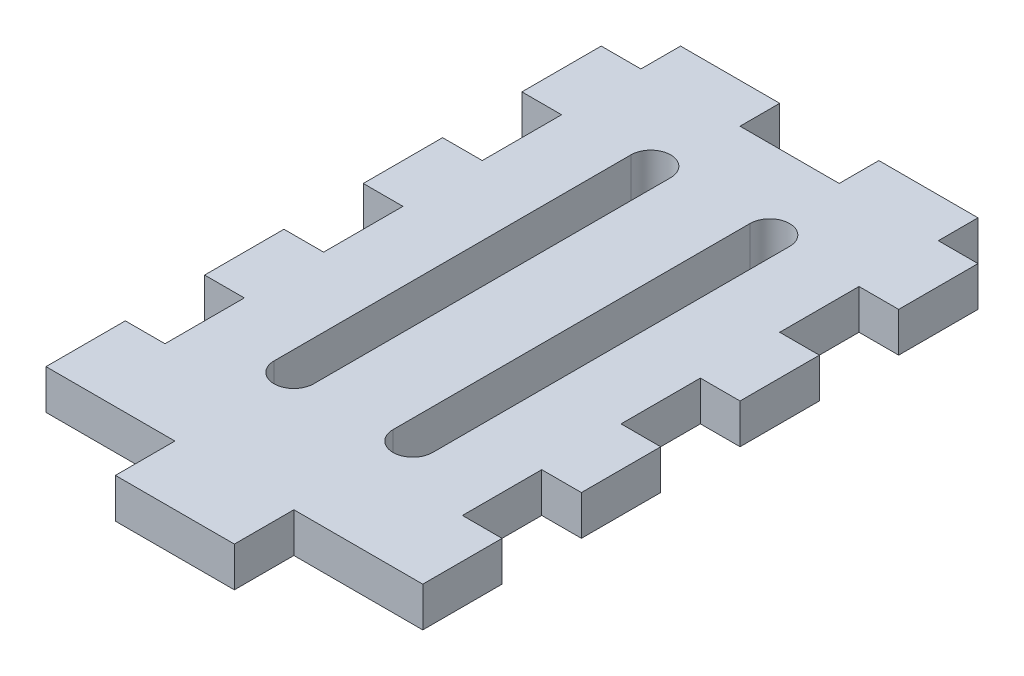
from build123d import *

# Parameters (mm, degrees)
BOSS_EXTRUDE1_DEPTH = 4


with BuildPart() as part:
    # Sketch1 → Boss-Extrude1 (new body)
    with BuildSketch(Plane(origin=(0, 0, 0), x_dir=(1, 0, 0), z_dir=(0, 1, 0))):
        Polygon((-5, 26), (5, 26), (5, 30), (15, 30), (15, 26), (19, 26), (19, 18), (15, 18), (15, 10), (19, 10), (19, 2), (15, 2), (15, -6), (19, -6), (19, -14), (15, -14), (15, -22), (19, -22), (19, -30), (15, -30), (6, -30), (6, -36), (-6, -36), (-6, -30), (-15, -30), (-19, -30), (-19, -22), (-15, -22), (-15, -14), (-19, -14), (-19, -6), (-15, -6), (-15, 2), (-19, 2), (-19, 10), (-15, 10), (-15, 18), (-19, 18), (-19, 26), (-15, 26), (-15, 30), (-5, 30), align=None)
        with BuildLine():
            Line((-8, -18), (-8, 18))
            ThreePointArc((-8, 18), (-6, 20), (-4, 18))
            Line((-4, 18), (-4, -18))
            ThreePointArc((-4, -18), (-6, -20), (-8, -18))
        make_face(mode=Mode.SUBTRACT)
        with BuildLine():
            Line((8, -18), (8, 18))
            ThreePointArc((8, 18), (6, 20), (4, 18))
            Line((4, 18), (4, -18))
            ThreePointArc((4, -18), (6, -20), (8, -18))
        make_face(mode=Mode.SUBTRACT)
    extrude(amount=BOSS_EXTRUDE1_DEPTH)


solid = part.part
